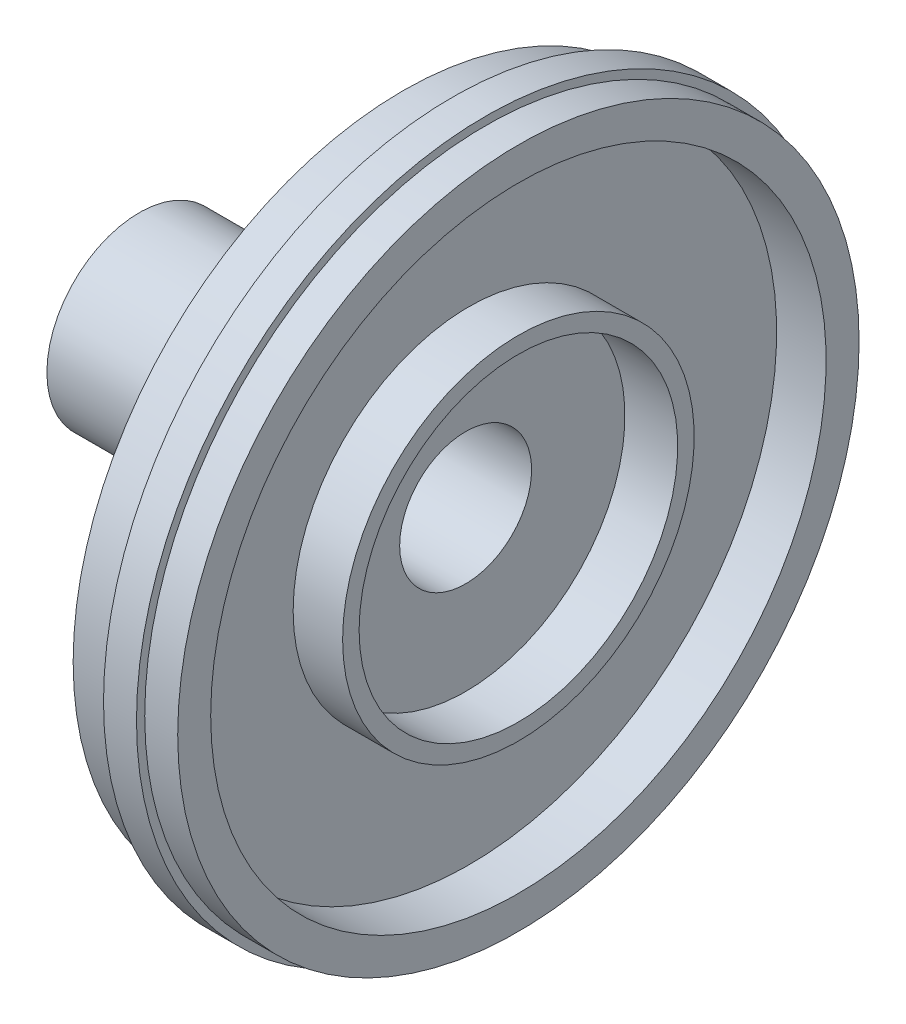
from build123d import *


with BuildPart() as part:
    # Sketch1 → Revolve1 (revolve)
    with BuildSketch(Plane.XY, mode=Mode.PRIVATE) as revolve1_sk:
        Polygon((0, 6.35), (31.4198, 6.35), (31.4198, 15.33525), (36.4998, 15.33525), (36.4998, 16.92275), (31.7373, 16.92275), (31.7373, 29.62275), (36.4998, 29.62275), (36.4998, 32.79775), (33.3248, 32.79775), (33.3248, 33.5915), (30.1498, 33.5915), (30.1498, 31.75), (25.3873, 31.75), (25.3873, 28.575), (30.1498, 28.575), (30.1498, 19.05), (26.9748, 19.05), (26.9748, 9.525), (19.05, 9.525), (19.05, 8.89), (0, 8.89), align=None)
    revolve(revolve1_sk.sketch.rotate(Axis((0, 0, 0), (1, 0, 0)), 90), axis=Axis((0, 0, 0), (1, 0, 0)))


solid = part.part
